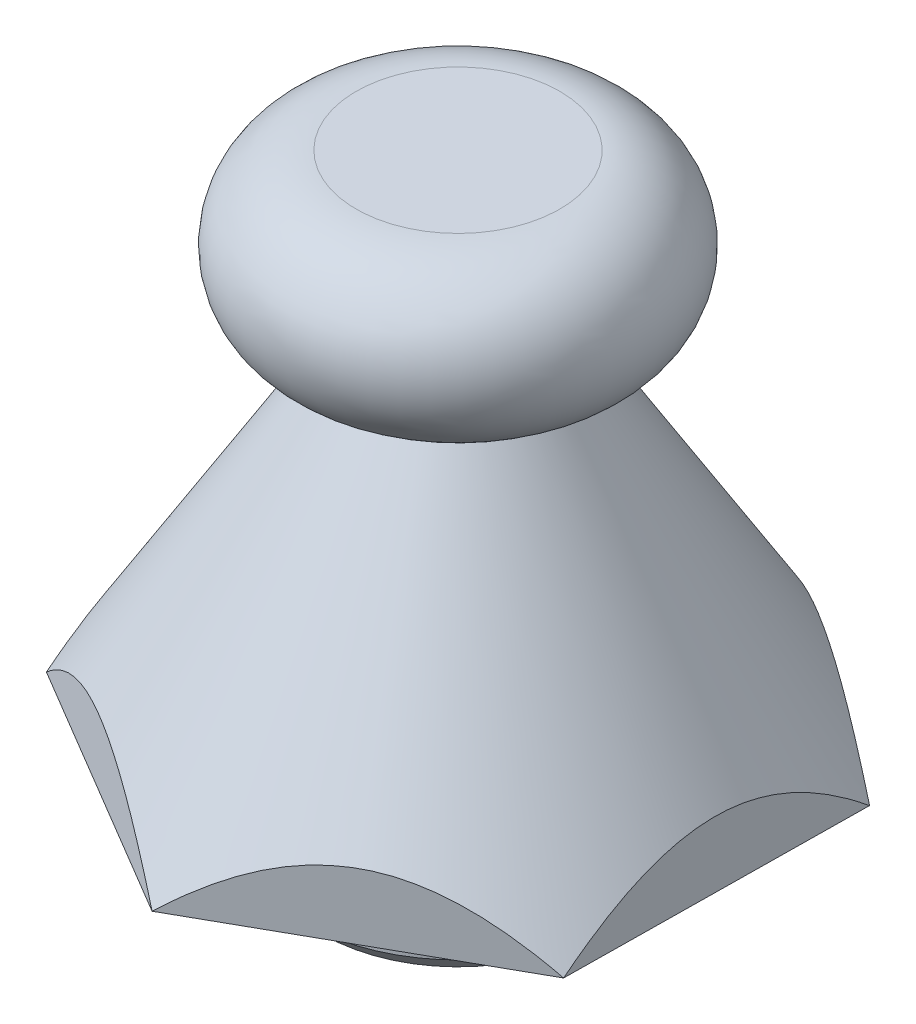
from build123d import *

# Parameters (mm, degrees)
SKETCH2_OUTSIDE_W  = 41.962
SKETCH2_OUTSIDE_H  = 41.962
CUT_EXTRUDE1_DEPTH = 37.599869445
CHAMFER1_SIZE      = 1


with BuildPart() as part:
    # Sketch1 → Revolve1 (revolve)
    with BuildSketch(Plane.XY, mode=Mode.PRIVATE) as revolve1_sk:
        with BuildLine():
            Line((0, 30), (-5, 30))
            ThreePointArc((-5, 30), (-8.987504197, 25.684072353), (-4.370118592, 22.049905139))
            Line((-4.370118592, 22.049905139), (-14.824817763, 5))
            Line((-14.824817763, 5), (-7.627118644, 5))
            Line((-7.627118644, 5), (-7.627118644, 0))
            Line((-7.627118644, 0), (0, 0))
            Line((0, 0), (0, 30))
        make_face()
    revolve(revolve1_sk.sketch.rotate(Axis((0, 0, 0), (0, 1, 0)), 270), axis=Axis((0, 0, 0), (0, 1, 0)))

    # Sketch2 outside → Cut-Extrude1 (cut, through all)
    with BuildSketch(Plane(origin=(0, 30, 0), x_dir=(1, 0, 0), z_dir=(0, 1, 0))):
        Rectangle(SKETCH2_OUTSIDE_W, SKETCH2_OUTSIDE_H)
        Polygon((-12.927457346, -7.256450114), (-0.179458533, -14.823731525), (12.747998813, -7.567281411), (12.927457346, 7.256450114), (0.179458533, 14.823731525), (-12.747998813, 7.567281411), align=None, mode=Mode.SUBTRACT)
    extrude(amount=-CUT_EXTRUDE1_DEPTH, mode=Mode.SUBTRACT)

    # Chamfer1
    chamfer1_edges = [part.edges().sort_by_distance(p)[0] for p in [
        (0, 0, 7.627118644),
    ]]
    chamfer(chamfer1_edges, length=CHAMFER1_SIZE)


solid = part.part
